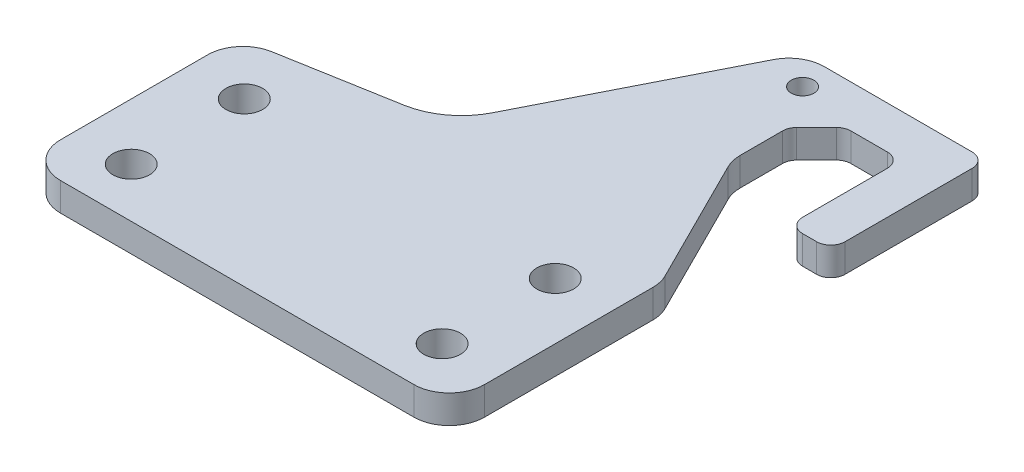
from build123d import *

# Parameters (mm, degrees)
EXTRUDE_1_DEPTH     = 4
FILLET_1_R          = 10
FILLET_2_R          = 5
SKETCH_2_R          = 2.6
CUT_EXTRUDE_1_DEPTH = 62.032778079
SKETCH_3_R          = 1.6
CUT_EXTRUDE_2_DEPTH = 62.032778079
EXTRUDE_2_DEPTH     = 4
FILLET_3_R          = 2


with BuildPart() as part:
    # 草图1 → 凸台-拉伸1 (new body)
    with BuildSketch(Plane(origin=(0, 0, 0), x_dir=(1, 0, 0), z_dir=(0, 1, 0))):
        Polygon((-30, -15), (30, -15), (30, 15), (20, 35), (20, 43), (24, 47), (24, 53), (12, 53), (-5, 19.408174518), (-30, 15), align=None)
    extrude(amount=EXTRUDE_1_DEPTH)

    # 圆角1
    fillet_1_edges = [part.edges().sort_by_distance(p)[0] for p in [
        (-5, 2, -19.408174518),
    ]]
    fillet(fillet_1_edges, radius=FILLET_1_R)

    # 圆角2
    fillet_2_edges = [part.edges().sort_by_distance(p)[0] for p in [
        (30, 2, -15),
        (30, 2, 15),
        (-30, 2, 15),
        (-30, 2, -15),
        (12, 2, -53),
        (20, 2, -35),
    ]]
    fillet(fillet_2_edges, radius=FILLET_2_R)

    # 草图2 → 切除-拉伸1 (cut, through all)
    with BuildSketch(Plane(origin=(0, 4, 0), x_dir=(1, 0, 0), z_dir=(0, 1, 0))):
        with Locations(Location((-22, 8, 0), (0, 0, 270))):
            Circle(SKETCH_2_R)
        with Locations(Location((22, 8, 0), (0, 0, 90))):
            Circle(SKETCH_2_R)
        with Locations(Location((22, -8, 0), (0, 0, 270))):
            Circle(SKETCH_2_R)
        with Locations(Location((-22, -8, 0), (0, 0, 90))):
            Circle(SKETCH_2_R)
    extrude(amount=-CUT_EXTRUDE_1_DEPTH, mode=Mode.SUBTRACT)

    # 草图3 → 切除-拉伸2 (cut, through all)
    with BuildSketch(Plane.XZ):
        with Locations(Location((16, -49, 0), (0, 0, 270))):
            Circle(SKETCH_3_R)
    extrude(amount=-CUT_EXTRUDE_2_DEPTH, mode=Mode.SUBTRACT)

    # 草图4 → 凸台-拉伸2 (add)
    with BuildSketch(Plane(origin=(0, 4, 0), x_dir=(1, 0, 0), z_dir=(0, 1, 0))):
        Polygon((24, 47), (32, 47), (32, 31), (38, 31), (38, 53), (24, 53), align=None)
    extrude(amount=-EXTRUDE_2_DEPTH)

    # 圆角3
    fillet_3_edges = [part.edges().sort_by_distance(p)[0] for p in [
        (38, 2, -53),
        (38, 2, -31),
        (32, 2, -31),
        (32, 2, -47),
        (24, 2, -47),
        (20, 2, -43),
    ]]
    fillet(fillet_3_edges, radius=FILLET_3_R)


solid = part.part
